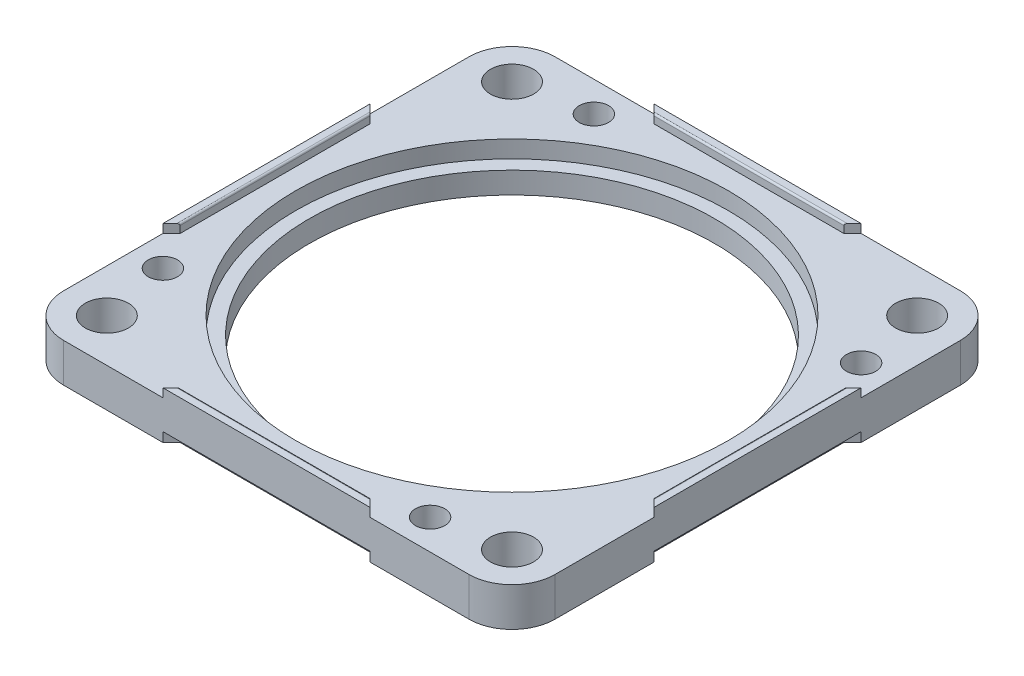
from build123d import *

# Parameters (mm, degrees)
SKETCH1_W                = 57
SKETCH1_H                = 57
BOSS_EXTRUDE1_DEPTH      = 4.5
FILLET1_R                = 5
SKETCH2_R                = 2.5
SKETCH2_R_2              = 1.7
CUT_EXTRUDE1_DEPTH       = 41.555517504
BOSS_EXTRUDE2_DEPTH      = 1
FILLET2_R                = 0.2
SKETCH4_R                = 23.5
CUT_EXTRUDE2_DEPTH       = 41.555517504
SKETCH4_3_R              = 25.1
SKETCH4_3_R_2            = 23.5
CUT_EXTRUDE3_DEPTH       = 2
CUT_EXTRUDE4_DEPTH       = 1.1
CIRPATTERN1_COUNT        = 4
FILLET2_OF_CIRPATTERN1_R = 0.2


with BuildPart() as part:
    # Sketch1 → Boss-Extrude1 (new body)
    with BuildSketch(Plane(origin=(0, 0, 0), x_dir=(1, 0, 0), z_dir=(0, 1, 0))):
        Rectangle(SKETCH1_W, SKETCH1_H)
    extrude(amount=BOSS_EXTRUDE1_DEPTH)

    # Fillet1
    fillet1_edges = [part.edges().sort_by_distance(p)[0] for p in [
        (-28.5, 2.25, -28.5),
        (28.5, 2.25, -28.5),
        (-28.5, 2.25, 28.5),
        (28.5, 2.25, 28.5),
    ]]
    fillet(fillet1_edges, radius=FILLET1_R)

    # Sketch2 → Cut-Extrude1 (cut, through all)
    with BuildSketch(Plane(origin=(0, 4.5, 0), x_dir=(1, 0, 0), z_dir=(0, 1, 0))):
        with Locations((-23.5, 23.5)):
            Circle(SKETCH2_R)
        with Locations((-15.5, 25)):
            Circle(SKETCH2_R_2)
    cut_extrude1 = extrude(amount=-CUT_EXTRUDE1_DEPTH, mode=Mode.SUBTRACT)

    # Sketch3 → Boss-Extrude2 (add)
    with BuildSketch(Plane(origin=(0, 4.5, 0), x_dir=(1, 0, 0), z_dir=(0, 1, 0))):
        Polygon((11, 27.5), (-11, 27.5), (-12, 28.5), (12, 28.5), align=None)
    boss_extrude2 = extrude(amount=BOSS_EXTRUDE2_DEPTH)

    # Fillet2
    fillet2_edges = [part.edges().sort_by_distance(p)[0] for p in [
        (0, 5.5, -27.5),
    ]]
    fillet(fillet2_edges, radius=FILLET2_R)

    # Sketch4 → Cut-Extrude2 (cut, through all)
    with BuildSketch(Plane(origin=(0, 4.5, 0), x_dir=(1, 0, 0), z_dir=(0, 1, 0))):
        Circle(SKETCH4_R)
    extrude(amount=-CUT_EXTRUDE2_DEPTH, mode=Mode.SUBTRACT)

    # Sketch4<3> → Cut-Extrude3 (cut)
    with BuildSketch(Plane(origin=(0, 4.5, 0), x_dir=(1, 0, 0), z_dir=(0, 1, 0))):
        Circle(SKETCH4_3_R)
        Circle(SKETCH4_3_R_2, mode=Mode.SUBTRACT)
    extrude(amount=-CUT_EXTRUDE3_DEPTH, mode=Mode.SUBTRACT)

    # Sketch5 → Cut-Extrude4 (cut)
    with BuildSketch(Plane.XZ):
        Polygon((-11, -27.5), (11, -27.5), (12, -28.5), (-12, -28.5), align=None)
    cut_extrude4 = extrude(amount=-CUT_EXTRUDE4_DEPTH, mode=Mode.SUBTRACT)

    # CirPattern1: Cut-Extrude1, Boss-Extrude2, Cut-Extrude4 ×4 about axis
    cirpattern1_axis = Axis((0, 2.5, 0), (0, 1, 0))
    add([cut_extrude1.rotate(cirpattern1_axis, i * 360 / CIRPATTERN1_COUNT) for i in range(1, CIRPATTERN1_COUNT)], mode=Mode.SUBTRACT)
    add([boss_extrude2.rotate(cirpattern1_axis, i * 360 / CIRPATTERN1_COUNT) for i in range(1, CIRPATTERN1_COUNT)])
    add([cut_extrude4.rotate(cirpattern1_axis, i * 360 / CIRPATTERN1_COUNT) for i in range(1, CIRPATTERN1_COUNT)], mode=Mode.SUBTRACT)

    # Fillet2 of CirPattern1
    fillet2_of_cirpattern1_edges = [part.edges().sort_by_distance(p)[0] for p in [
        (-27.5, 5.5, 0),
        (0, 5.5, 27.5),
        (27.5, 5.5, 0),
    ]]
    fillet(fillet2_of_cirpattern1_edges, radius=FILLET2_OF_CIRPATTERN1_R)


solid = part.part
